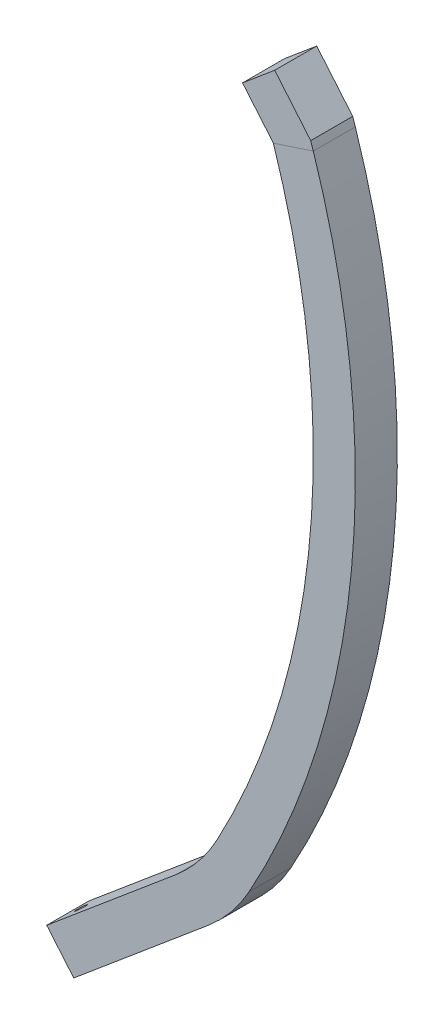
from build123d import *

# Parameters (mm, degrees)
AUFSATZ_LINEAR_AUSTRAGEN1_DEPTH    = 12
AUFSATZ_LINEAR_AUSTRAGEN3_DEPTH    = 12
AUFSATZ_LINEAR_AUSTRAGEN4_DEPTH    = 12
SCHNITT_LINEAR_AUSTRAGEN1_DEPTH    = 254.175024926
VERRUNDUNG1_R                      = 50
SKIZZE9_W                          = 12
SKIZZE9_H                          = 12
AUFSATZ_LINEAR_AUSTRAGEN6_DEPTH    = 11
SKIZZE11_R                         = 1.55
SCHNITT_LINEAR_AUSTRAGEN4_DEPTH    = 222.40836864
K_RPER_VERSCHIEBEN_KOPIEREN2_ANGLE = 120


with BuildPart() as part:
    # Skizze1 → Aufsatz-Linear austragen1 (new body)
    with BuildSketch(Plane(origin=(0, 0, 0), x_dir=(0, 0, -1), z_dir=(1, 0, 0))):
        with BuildLine():
            Line((-240, 65), (-230.735708163, 72.773663864))
            ThreePointArc((-230.735708163, 72.773663864), (-123.944567763, 17.242039243), (-3.735818811, 23.403668612))
            Line((-3.735818811, 23.403668612), (0, 12))
            ThreePointArc((0, 12), (-127.247502729, 5.681119716), (-240, 65))
        make_face()
    extrude(amount=AUFSATZ_LINEAR_AUSTRAGEN1_DEPTH)

    # Skizze5 → Aufsatz-Linear austragen4 (add)
    with BuildSketch(Plane(origin=(12, 0, 0), x_dir=(0, 0, -1), z_dir=(1, 0, 0))):
        Polygon((-231.662517154, 71.995978781), (-222.469983836, 79.709430098), (-210.899806862, 65.920630121), (-192.948331238, 44.526894555), (-220.092340179, 58.207178805), align=None)
    extrude(amount=-AUFSATZ_LINEAR_AUSTRAGEN4_DEPTH)

    # Skizze6 → Schnitt-Linear austragen1 (cut, through all)
    with BuildSketch(Plane(origin=(12, 0, 0), x_dir=(0, 0, -1), z_dir=(1, 0, 0))):
        Polygon((-231.662517154, 71.995978781), (-199.510648028, 33.678873242), (-204.367668784, 29.603348917), (-240, 65), align=None)
    extrude(amount=-SCHNITT_LINEAR_AUSTRAGEN1_DEPTH, mode=Mode.SUBTRACT)

    # Verrundung1
    verrundung1_edges = [part.edges().sort_by_distance(p)[0] for p in [
        (6, 44.526894555, 192.948331238),
        (6, 35.285406895, 200.858689823),
    ]]
    fillet(verrundung1_edges, radius=VERRUNDUNG1_R)

    # Skizze9 → Aufsatz-Linear austragen6 (add)
    with BuildSketch(Plane(origin=(0, 156.320496136, 131.168470653), x_dir=(1, 0, 0), z_dir=(0, 0.7660444431189836, 0.6427876096865328))):
        with Locations((6, -125.185660837)):
            Rectangle(SKIZZE9_W, SKIZZE9_H)
    extrude(amount=AUFSATZ_LINEAR_AUSTRAGEN6_DEPTH)

    # Skizze11 → Schnitt-Linear austragen4 (cut, through all)
    with BuildSketch(Plane(origin=(0, -76.611066038, 91.301513183), x_dir=(-1, 0, 0), z_dir=(0, 0.6427876096865329, -0.7660444431189836))):
        with Locations(Location((-6, 210.061915128, 0), (0, 0, 90))):
            Circle(SKIZZE11_R)
    extrude(amount=-SCHNITT_LINEAR_AUSTRAGEN4_DEPTH, mode=Mode.SUBTRACT)


with BuildPart() as body_2:
    # Skizze4 → Aufsatz-Linear austragen3 (new body)
    with BuildSketch(Plane(origin=(0, 0, 0), x_dir=(0, 0, -1), z_dir=(1, 0, 0))):
        with BuildLine():
            Line((-3.735818811, 23.403668612), (6.769031275, 32.218284445))
            Line((6.769031275, 32.218284445), (14.482482591, 23.025751128))
            Line((14.482482591, 23.025751128), (2.225771501, 12.741149373))
            ThreePointArc((2.225771501, 12.741149373), (1.113785782, 12.367871772), (0, 12))
            Line((0, 12), (-3.735818811, 23.403668612))
        make_face()
    extrude(amount=AUFSATZ_LINEAR_AUSTRAGEN3_DEPTH)


with BuildPart() as part_1:
    # Körper-Verschieben/Kopieren2: moved
    add(part.part.rotate(Axis((-3.969359472, 43.057910326, 47.027269798), (0.5773502691896252, -0.5773502691896272, 0.5773502691896252)), K_RPER_VERSCHIEBEN_KOPIEREN2_ANGLE))


with BuildPart() as body_2_1:
    # Körper-Verschieben/Kopieren2: moved
    add(body_2.part.rotate(Axis((-3.969359472, 43.057910326, 47.027269798), (0.5773502691896252, -0.5773502691896272, 0.5773502691896252)), K_RPER_VERSCHIEBEN_KOPIEREN2_ANGLE))


solid = Compound([part_1.part, body_2_1.part])
